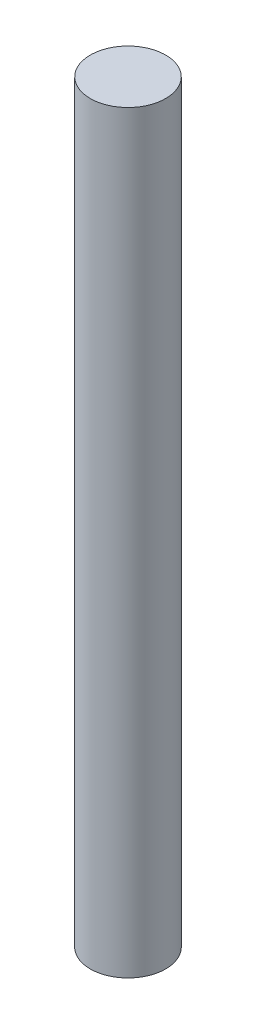
from build123d import *

# Parameters (mm, degrees)
CROQUIS1_R              = 2.5
SALIENTE_EXTRUIR1_DEPTH = 50


with BuildPart() as part:
    # Croquis1 → Saliente-Extruir1 (new body)
    with BuildSketch(Plane(origin=(0, 0, 0), x_dir=(1, 0, 0), z_dir=(0, 1, 0))):
        with Locations(Location((0, 0, 0), (0, 0, 270))):
            Circle(CROQUIS1_R)
    extrude(amount=SALIENTE_EXTRUIR1_DEPTH)


solid = part.part
